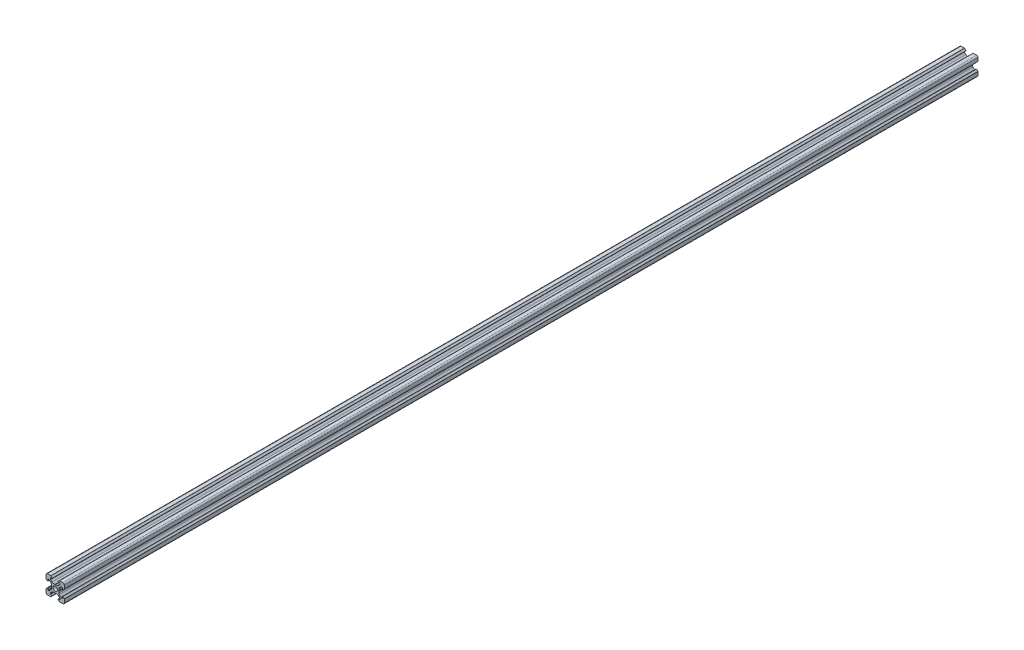
from build123d import *

# Parameters (mm, degrees)
SKETCH_186_R      = 2.5
EXTRUDE_729_DEPTH = 1000


with BuildPart() as part:
    # Sketch 186 → Extrude 729 (new body)
    with BuildSketch(Plane.XY):
        with BuildLine():
            Line((-4, 1.898780669), (-4, 0.337695265))
            ThreePointArc((-4, 0.337695265), (-3.98590708, 0.254943529), (-3.945217202, 0.181521503))
            Line((-3.945217202, 0.181521503), (-3.8, 0))
            Line((-3.8, 0), (-3.945217202, -0.181521503))
            ThreePointArc((-3.945217202, -0.181521503), (-3.98590708, -0.254943529), (-4, -0.337695265))
            Line((-4, -0.337695265), (-4, -1.898780669))
            ThreePointArc((-4, -1.898780669), (-4.152240935, -2.664147534), (-4.585786438, -3.312994231))
            Line((-4.585786438, -3.312994231), (-6.279898987, -5.007106781))
            ThreePointArc((-6.279898987, -5.007106781), (-6.604322336, -5.223879533), (-6.987005769, -5.3))
            Line((-6.987005769, -5.3), (-7.8, -5.3))
            ThreePointArc((-7.8, -5.3), (-7.941421356, -5.241421356), (-8, -5.1))
            Line((-8, -5.1), (-8, -3.33))
            ThreePointArc((-8, -3.33), (-8.154329142, -3.099030117), (-8.426776695, -3.153223305))
            Line((-8.426776695, -3.153223305), (-9.926776695, -4.653223305))
            ThreePointArc((-9.926776695, -4.653223305), (-9.980969883, -4.734329142), (-10, -4.83))
            Line((-10, -4.83), (-10, -8.5))
            ThreePointArc((-10, -8.5), (-9.560660172, -9.560660172), (-8.5, -10))
            Line((-8.5, -10), (-4.83, -10))
            ThreePointArc((-4.83, -10), (-4.734329142, -9.980969883), (-4.653223305, -9.926776695))
            Line((-4.653223305, -9.926776695), (-3.153223305, -8.426776695))
            ThreePointArc((-3.153223305, -8.426776695), (-3.099030117, -8.154329142), (-3.33, -8))
            Line((-3.33, -8), (-5.1, -8))
            ThreePointArc((-5.1, -8), (-5.241421356, -7.941421356), (-5.3, -7.8))
            Line((-5.3, -7.8), (-5.3, -6.987005769))
            ThreePointArc((-5.3, -6.987005769), (-5.223879533, -6.604322336), (-5.007106781, -6.279898987))
            Line((-5.007106781, -6.279898987), (-3.312994231, -4.585786438))
            ThreePointArc((-3.312994231, -4.585786438), (-2.664147534, -4.152240935), (-1.898780669, -4))
            Line((-1.898780669, -4), (-0.337695265, -4))
            ThreePointArc((-0.337695265, -4), (-0.254943529, -3.98590708), (-0.181521503, -3.945217202))
            Line((-0.181521503, -3.945217202), (0, -3.8))
            Line((0, -3.8), (0.181521503, -3.945217202))
            ThreePointArc((0.181521503, -3.945217202), (0.254943529, -3.98590708), (0.337695265, -4))
            Line((0.337695265, -4), (1.898780669, -4))
            ThreePointArc((1.898780669, -4), (2.664147534, -4.152240935), (3.312994231, -4.585786438))
            Line((3.312994231, -4.585786438), (5.007106781, -6.279898987))
            ThreePointArc((5.007106781, -6.279898987), (5.223879533, -6.604322336), (5.3, -6.987005769))
            Line((5.3, -6.987005769), (5.3, -7.8))
            ThreePointArc((5.3, -7.8), (5.241421356, -7.941421356), (5.1, -8))
            Line((5.1, -8), (3.33, -8))
            ThreePointArc((3.33, -8), (3.099030117, -8.154329142), (3.153223305, -8.426776695))
            Line((3.153223305, -8.426776695), (4.653223305, -9.926776695))
            ThreePointArc((4.653223305, -9.926776695), (4.734329142, -9.980969883), (4.83, -10))
            Line((4.83, -10), (8.5, -10))
            ThreePointArc((8.5, -10), (9.560660172, -9.560660172), (10, -8.5))
            Line((10, -8.5), (10, -4.83))
            ThreePointArc((10, -4.83), (9.980969883, -4.734329142), (9.926776695, -4.653223305))
            Line((9.926776695, -4.653223305), (8.426776695, -3.153223305))
            ThreePointArc((8.426776695, -3.153223305), (8.154329142, -3.099030117), (8, -3.33))
            Line((8, -3.33), (8, -5.1))
            ThreePointArc((8, -5.1), (7.941421356, -5.241421356), (7.8, -5.3))
            Line((7.8, -5.3), (6.987005769, -5.3))
            ThreePointArc((6.987005769, -5.3), (6.604322336, -5.223879533), (6.279898987, -5.007106781))
            Line((6.279898987, -5.007106781), (4.585786438, -3.312994231))
            ThreePointArc((4.585786438, -3.312994231), (4.152240935, -2.664147534), (4, -1.898780669))
            Line((4, -1.898780669), (4, -0.337695265))
            ThreePointArc((4, -0.337695265), (3.98590708, -0.254943529), (3.945217202, -0.181521503))
            Line((3.945217202, -0.181521503), (3.8, 0))
            Line((3.8, 0), (3.945217202, 0.181521503))
            ThreePointArc((3.945217202, 0.181521503), (3.98590708, 0.254943529), (4, 0.337695265))
            Line((4, 0.337695265), (4, 1.898780669))
            ThreePointArc((4, 1.898780669), (4.152240935, 2.664147534), (4.585786438, 3.312994231))
            Line((4.585786438, 3.312994231), (6.279898987, 5.007106781))
            ThreePointArc((6.279898987, 5.007106781), (6.604322336, 5.223879533), (6.987005769, 5.3))
            Line((6.987005769, 5.3), (7.8, 5.3))
            ThreePointArc((7.8, 5.3), (7.941421356, 5.241421356), (8, 5.1))
            Line((8, 5.1), (8, 3.33))
            ThreePointArc((8, 3.33), (8.154329142, 3.099030117), (8.426776695, 3.153223305))
            Line((8.426776695, 3.153223305), (9.926776695, 4.653223305))
            ThreePointArc((9.926776695, 4.653223305), (9.980969883, 4.734329142), (10, 4.83))
            Line((10, 4.83), (10, 8.5))
            ThreePointArc((10, 8.5), (9.560660172, 9.560660172), (8.5, 10))
            Line((8.5, 10), (4.83, 10))
            ThreePointArc((4.83, 10), (4.734329142, 9.980969883), (4.653223305, 9.926776695))
            Line((4.653223305, 9.926776695), (3.153223305, 8.426776695))
            ThreePointArc((3.153223305, 8.426776695), (3.099030117, 8.154329142), (3.33, 8))
            Line((3.33, 8), (5.1, 8))
            ThreePointArc((5.1, 8), (5.241421356, 7.941421356), (5.3, 7.8))
            Line((5.3, 7.8), (5.3, 6.987005769))
            ThreePointArc((5.3, 6.987005769), (5.223879533, 6.604322336), (5.007106781, 6.279898987))
            Line((5.007106781, 6.279898987), (3.312994231, 4.585786438))
            ThreePointArc((3.312994231, 4.585786438), (2.664147534, 4.152240935), (1.898780669, 4))
            Line((1.898780669, 4), (0.337695265, 4))
            ThreePointArc((0.337695265, 4), (0.254943529, 3.98590708), (0.181521503, 3.945217202))
            Line((0.181521503, 3.945217202), (0, 3.8))
            Line((0, 3.8), (-0.181521503, 3.945217202))
            ThreePointArc((-0.181521503, 3.945217202), (-0.254943529, 3.98590708), (-0.337695265, 4))
            Line((-0.337695265, 4), (-1.898780669, 4))
            ThreePointArc((-1.898780669, 4), (-2.664147534, 4.152240935), (-3.312994231, 4.585786438))
            Line((-3.312994231, 4.585786438), (-5.007106781, 6.279898987))
            ThreePointArc((-5.007106781, 6.279898987), (-5.223879533, 6.604322336), (-5.3, 6.987005769))
            Line((-5.3, 6.987005769), (-5.3, 7.8))
            ThreePointArc((-5.3, 7.8), (-5.241421356, 7.941421356), (-5.1, 8))
            Line((-5.1, 8), (-3.33, 8))
            ThreePointArc((-3.33, 8), (-3.099030117, 8.154329142), (-3.153223305, 8.426776695))
            Line((-3.153223305, 8.426776695), (-4.653223305, 9.926776695))
            ThreePointArc((-4.653223305, 9.926776695), (-4.734329142, 9.980969883), (-4.83, 10))
            Line((-4.83, 10), (-8.5, 10))
            ThreePointArc((-8.5, 10), (-9.560660172, 9.560660172), (-10, 8.5))
            Line((-10, 8.5), (-10, 4.83))
            ThreePointArc((-10, 4.83), (-9.980969883, 4.734329142), (-9.926776695, 4.653223305))
            Line((-9.926776695, 4.653223305), (-8.426776695, 3.153223305))
            ThreePointArc((-8.426776695, 3.153223305), (-8.154329142, 3.099030117), (-8, 3.33))
            Line((-8, 3.33), (-8, 5.1))
            ThreePointArc((-8, 5.1), (-7.941421356, 5.241421356), (-7.8, 5.3))
            Line((-7.8, 5.3), (-6.987005769, 5.3))
            ThreePointArc((-6.987005769, 5.3), (-6.604322336, 5.223879533), (-6.279898987, 5.007106781))
            Line((-6.279898987, 5.007106781), (-4.585786438, 3.312994231))
            ThreePointArc((-4.585786438, 3.312994231), (-4.152240935, 2.664147534), (-4, 1.898780669))
        make_face()
        with Locations(Location((0, 0, 0), (0, 0, 180))):
            Circle(SKETCH_186_R, mode=Mode.SUBTRACT)
    extrude(amount=-EXTRUDE_729_DEPTH)


solid = part.part
